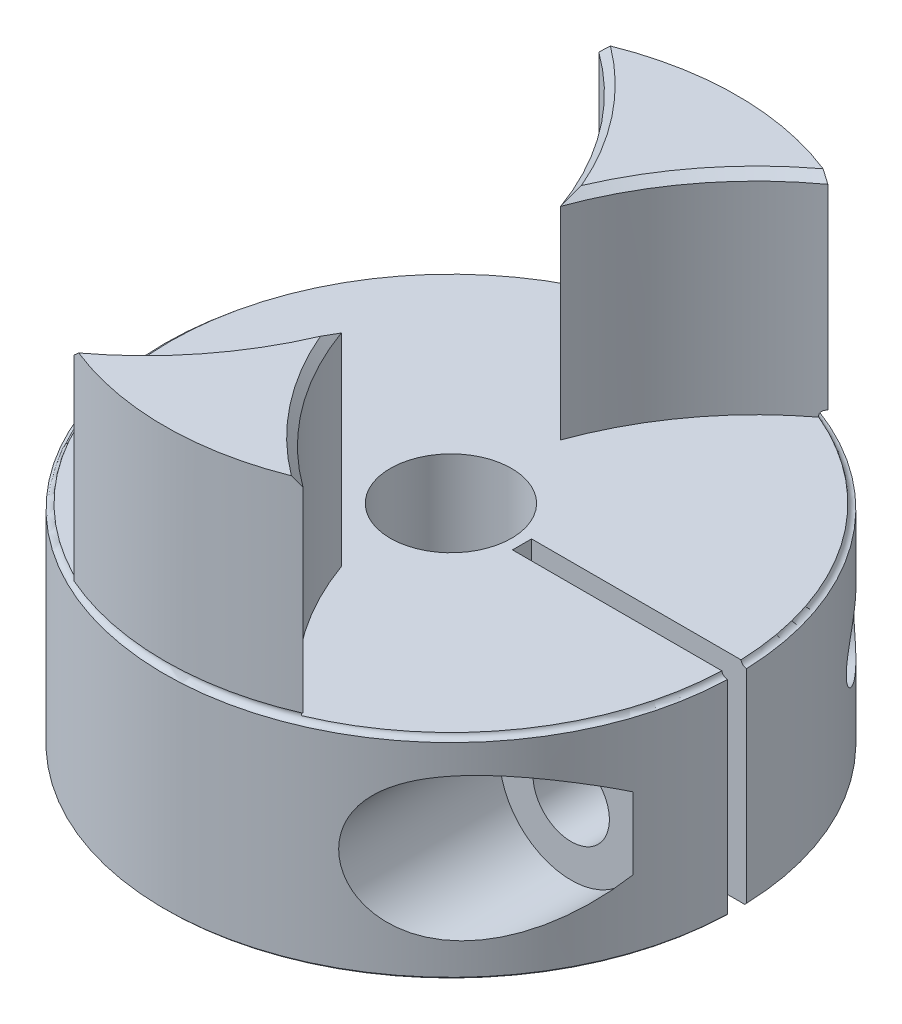
from build123d import *

# Parameters (mm, degrees)
SKETCH1_R             = 15
BOSS_EXTRUDE1_DEPTH   = 11
SKETCH2_R             = 3.175
CUT_EXTRUDE1_DEPTH    = 23
SKETCH3_R             = 17
CUT_EXTRUDE2_DEPTH    = 11
CUT_EXTRUDE3_DEPTH    = 11
SKETCH5_W             = 16.165630516
SKETCH5_H             = 1
CUT_EXTRUDE4_DEPTH    = 21
SKETCH6_R             = 2
CUT_EXTRUDE5_DEPTH    = 21
CUT_EXTRUDE6_START    = -4.2
SKETCH7_R             = 3.75
CUT_EXTRUDE6_DEPTH    = 21
M4_TAPPED_HOLE1_D     = 3.3
M4_TAPPED_HOLE1_DEPTH = 20.1
M4_TAPPED_HOLE1_TIP   = 0.991420021
CHAMFER2_SIZE         = 0.1
PAH1_SIZE             = 0.4
IZIM1_R               = 0.3


with BuildPart() as part:
    # Sketch1 → Boss-Extrude1 (new, symmetric)
    with BuildSketch(Plane(origin=(0, 0, 0), x_dir=(1, 0, 0), z_dir=(0, 1, 0))):
        with Locations(Location((0, 0, 0), (0, 0, 270))):
            Circle(SKETCH1_R)
    extrude(amount=BOSS_EXTRUDE1_DEPTH, both=True)

    # Sketch2 → Cut-Extrude1 (cut)
    with BuildSketch(Plane(origin=(0, 11, 0), x_dir=(1, 0, 0), z_dir=(0, 1, 0))):
        with Locations(Location((0, 0, 0), (0, 0, 270))):
            Circle(SKETCH2_R)
    extrude(amount=-CUT_EXTRUDE1_DEPTH, mode=Mode.SUBTRACT)

    # Sketch3 → Cut-Extrude2 (cut)
    with BuildSketch(Plane(origin=(0, 11, 0), x_dir=(1, 0, 0), z_dir=(0, 1, 0))):
        with Locations((16, 0)):
            Circle(SKETCH3_R)
    extrude(amount=-CUT_EXTRUDE2_DEPTH, mode=Mode.SUBTRACT)

    # Sketch4 → Cut-Extrude3 (cut)
    with BuildSketch(Plane(origin=(0, 11, 0), x_dir=(1, 0, 0), z_dir=(0, 1, 0))):
        with BuildLine():
            ThreePointArc((-6, 13.747727085), (-15, 0), (-6, -13.747727085))
            ThreePointArc((-6, -13.747727085), (-1.6187903, -9.065363068), (0.716230469, -3.093160021))
            ThreePointArc((0.716230469, -3.093160021), (-3.175, 0), (0.716230469, 3.093160021))
            ThreePointArc((0.716230469, 3.093160021), (-1.6187903, 9.065363068), (-6, 13.747727085))
        make_face()
    extrude(amount=-CUT_EXTRUDE3_DEPTH, mode=Mode.SUBTRACT)

    # Sketch5 → Cut-Extrude4 (cut)
    with BuildSketch(Plane(origin=(0, 0, 0), x_dir=(1, 0, 0), z_dir=(0, 1, 0))):
        with Locations((11.807437966, 0)):
            Rectangle(SKETCH5_W, SKETCH5_H)
    extrude(amount=-CUT_EXTRUDE4_DEPTH, mode=Mode.SUBTRACT)

    # Sketch6 → Cut-Extrude5 (cut)
    with BuildSketch(Plane.XY):
        with Locations(Location((11, -5.5, 0), (0, 0, 180))):
            Circle(SKETCH6_R)
    extrude(amount=CUT_EXTRUDE5_DEPTH, mode=Mode.SUBTRACT)

    # Sketch7 → Cut-Extrude6 (cut)
    with BuildSketch(Plane(origin=(0, 0, 0.5), x_dir=(-1, 0, 0), z_dir=(0, 0, -1)).offset(CUT_EXTRUDE6_START)):
        with Locations((-11, -5.5)):
            Circle(SKETCH7_R)
    extrude(amount=-CUT_EXTRUDE6_DEPTH, mode=Mode.SUBTRACT)

    # M4 Tapped Hole1
    with Locations(Plane.XY.offset(-0.5)):
        with Locations((11, -5.5)):
            Hole(M4_TAPPED_HOLE1_D / 2, depth=M4_TAPPED_HOLE1_DEPTH)
            with Locations((0, 0, -(M4_TAPPED_HOLE1_DEPTH + M4_TAPPED_HOLE1_TIP / 2))):  # 118° drill point
                Cone(0, M4_TAPPED_HOLE1_D / 2, M4_TAPPED_HOLE1_TIP, mode=Mode.SUBTRACT)

    # Chamfer2
    chamfer2_edges = [part.edges().sort_by_distance(p)[0] for p in [
        (-15, -11, 0),
    ]]
    chamfer(chamfer2_edges, length=CHAMFER2_SIZE)

    # Pah1
    pah1_edges = [part.edges().sort_by_distance(p)[0] for p in [
        (2.398064099, 11, -10.197418288),
        (2.398064099, 11, 10.197418288),
        (-2.398064099, 11, 10.197418288),
        (-2.398064099, 11, -10.197418288),
    ]]
    chamfer(pah1_edges, length=PAH1_SIZE)

    # Çizim1 → Kes-Döndür4 (revolve, cut)
    with BuildSketch(Plane(origin=(0, 0, 0), x_dir=(0, 0, -1), z_dir=(1, 0, 0))):
        with Locations((15, 0.05)):
            Circle(IZIM1_R)
    revolve(axis=Axis((0, -10.9, 0), (0, 1, 0)), mode=Mode.SUBTRACT)


solid = part.part
